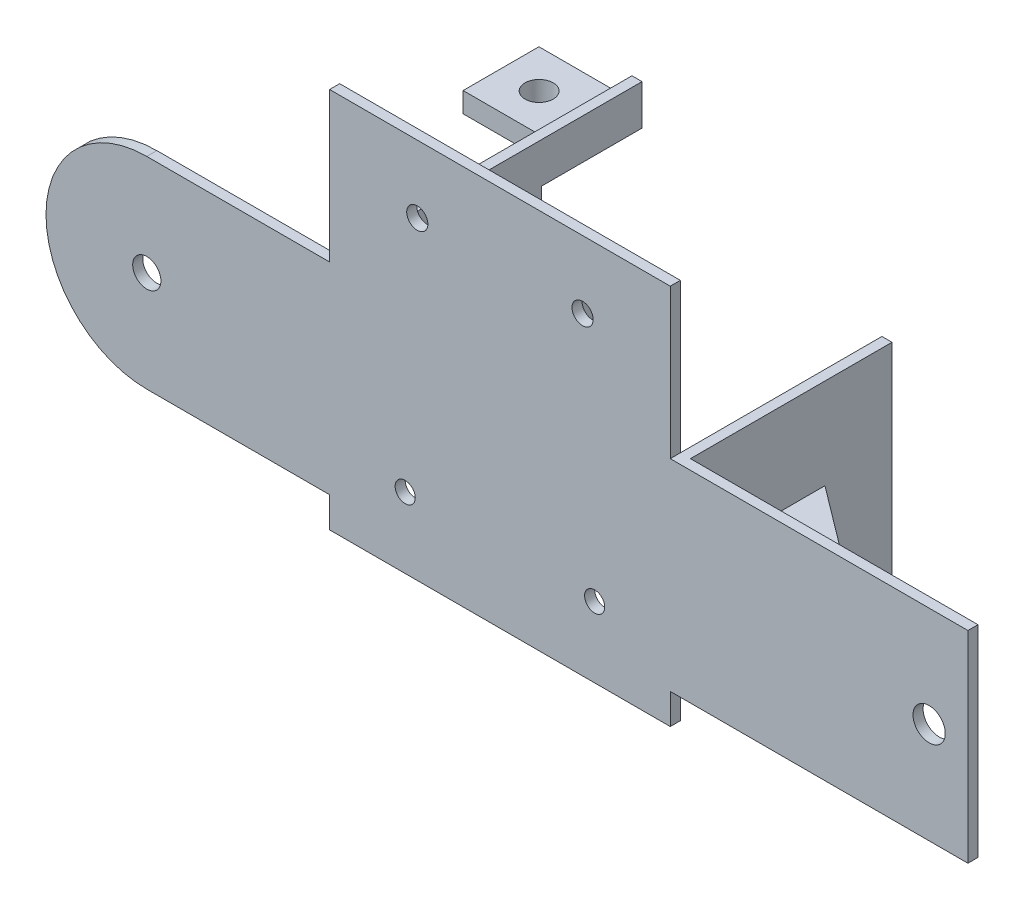
from build123d import *

# Parameters (mm, degrees)
CROQUIS1_R              = 7
CROQUIS1_R_2            = 5.25
CROQUIS1_R_3            = 5
CROQUIS1_R_4            = 8
SALIENTE_EXTRUIR1_DEPTH = 5
CROQUIS2_W              = 5
CROQUIS2_H              = 100
SALIENTE_EXTRUIR2_DEPTH = 100
CROQUIS3_W              = 5
CROQUIS3_H              = 20
SALIENTE_EXTRUIR3_DEPTH = 50
CROQUIS4_W              = 37.618444679
CROQUIS4_H              = 10
SALIENTE_EXTRUIR4_DEPTH = 40
CROQUIS5_R              = 7
CORTAR_EXTRUIR1_DEPTH   = 325.287034049
NERVIO1_REACH           = 304.992
CROQUIS6_WALL_W         = 701.273547134
CROQUIS6_WALL_H         = 10
NERVIO2_REACH           = 304.992
CROQUIS7_WALL_W         = 718.906485388
CROQUIS7_WALL_H         = 10


with BuildPart() as part:
    # Croquis1 → Saliente-Extruir1 (new body)
    with BuildSketch(Plane.XY):
        with BuildLine():
            Line((232.166801748, -404.895674081), (84.5, -404.895674081))
            Line((84.5, -404.895674081), (84.5, -330.787715528))
            Line((84.5, -330.787715528), (-84.5, -330.787715528))
            Line((-84.5, -330.787715528), (-84.5, -404.895674081))
            Line((-84.5, -404.895674081), (-175.19051762, -404.895674081))
            ThreePointArc((-175.19051762, -404.895674081), (-225.19051762, -454.895674081), (-175.19051762, -504.895674081))
            Line((-175.19051762, -504.895674081), (-84.5, -504.895674081))
            Line((-84.5, -504.895674081), (-84.5, -520))
            Line((-84.5, -520), (84.5, -520))
            Line((84.5, -520), (84.5, -504.895674081))
            Line((84.5, -504.895674081), (232.166801748, -504.895674081))
            Line((232.166801748, -504.895674081), (232.166801748, -404.895674081))
        make_face()
        with Locations((-175.19051762, -454.895674081)):
            Circle(CROQUIS1_R, mode=Mode.SUBTRACT)
        with Locations((41, -364.3)):
            Circle(CROQUIS1_R_2, mode=Mode.SUBTRACT)
        with Locations((-41, -364.3)):
            Circle(CROQUIS1_R_2, mode=Mode.SUBTRACT)
        with Locations((47, -485)):
            Circle(CROQUIS1_R_3, mode=Mode.SUBTRACT)
        with Locations((-47, -485)):
            Circle(CROQUIS1_R_3, mode=Mode.SUBTRACT)
        with Locations((212.922919346, -454.766206892)):
            Circle(CROQUIS1_R_4, mode=Mode.SUBTRACT)
    extrude(amount=SALIENTE_EXTRUIR1_DEPTH)

    # Croquis2 → Saliente-Extruir2 (add)
    with BuildSketch(Plane(origin=(0, 0, 0), x_dir=(-1, 0, 0), z_dir=(0, 0, -1))):
        with Locations((-87, -454.895674081)):
            Rectangle(CROQUIS2_W, CROQUIS2_H)
        with Locations((87, -454.895674081)):
            Rectangle(CROQUIS2_W, CROQUIS2_H)
    extrude(amount=SALIENTE_EXTRUIR2_DEPTH)

    # Croquis3 → Saliente-Extruir3 (add)
    with BuildSketch(Plane(origin=(0, 0, -100), x_dir=(-1, 0, 0), z_dir=(0, 0, -1))):
        with Locations((87, -494.895674081)):
            Rectangle(CROQUIS3_W, CROQUIS3_H)
        with Locations((87, -414.895674081)):
            Rectangle(CROQUIS3_W, CROQUIS3_H)
    extrude(amount=SALIENTE_EXTRUIR3_DEPTH)

    # Croquis4 → Saliente-Extruir4 (add)
    with BuildSketch(Plane.ZY.offset(89.5)):
        with Locations((-125.035404741, -414.350039231)):
            Rectangle(CROQUIS4_W, CROQUIS4_H)
        with Locations((-125.035404741, -495.377386848)):
            Rectangle(CROQUIS4_W, CROQUIS4_H)
    extrude(amount=SALIENTE_EXTRUIR4_DEPTH)

    # Croquis5 → Cortar-Extruir1 (cut, through all)
    with BuildSketch(Plane.XZ.offset(500.377386848)):
        with Locations(Location((-110.45279813, -124.886599464, 0), (0, 0, 270))):
            Circle(CROQUIS5_R)
    extrude(amount=-CORTAR_EXTRUIR1_DEPTH, mode=Mode.SUBTRACT)

    # Croquis6 wall → Nervio1 (add, up to next)
    with BuildSketch(Plane(origin=(-117.239432288, -454.895674081, -37.5), x_dir=(-0.594696602605, 0, 0.803950216649), z_dir=(-0.803950216649, 0, -0.594696602605)), mode=Mode.PRIVATE) as nervio1_sk1:
        Rectangle(CROQUIS6_WALL_W, CROQUIS6_WALL_H)
    nervio1_tool1 = extrude(nervio1_sk1.sketch, amount=-NERVIO1_REACH, mode=Mode.PRIVATE) - part.part
    add(nervio1_tool1.solids().sort_by_distance((-117.239432288, -454.895674081, -37.5))[0])

    # Croquis7 wall → Nervio2 (add, up to next)
    with BuildSketch(Plane(origin=(133.798766553, -454.895674081, -33.37002042), x_dir=(-0.79873511165, 0, -0.601682824599), z_dir=(0.601682824599, 0, -0.79873511165)), mode=Mode.PRIVATE) as nervio2_sk1:
        Rectangle(CROQUIS7_WALL_W, CROQUIS7_WALL_H)
    nervio2_tool1 = extrude(nervio2_sk1.sketch, amount=-NERVIO2_REACH, mode=Mode.PRIVATE) - part.part
    add(nervio2_tool1.solids().sort_by_distance((133.798766553, -454.895674081, -33.37002042))[0])


solid = part.part
